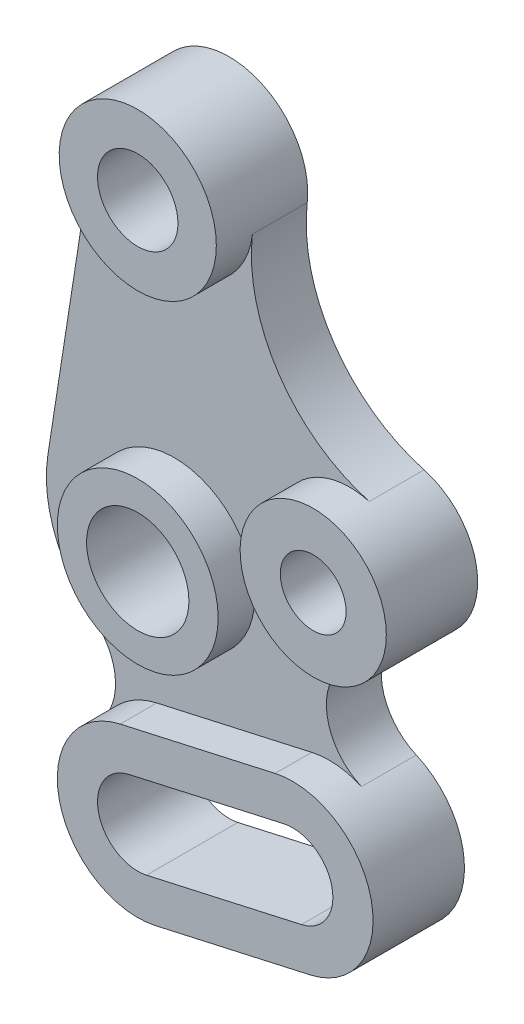
from build123d import *

# Parameters (mm, degrees)
SKETCH1_R           = 44
BOSS_EXTRUDE1_DEPTH = 30
SKETCH1_3_R         = 40
SKETCH1_3_R_2       = 18
SKETCH1_3_R_3       = 43
SKETCH1_3_R_4       = 22
SKETCH1_3_R_5       = 44
SKETCH1_3_R_6       = 28
BOSS_EXTRUDE2_DEPTH = 50


with BuildPart() as part:
    # Sketch1 → Boss-Extrude1 (new body)
    with BuildSketch(Plane.XY):
        with BuildLine():
            ThreePointArc((-37.152695317, -96.427192982), (-25.310496196, -84.008629057), (-9.618664602, -77.064218986))
            Line((-9.618664602, -77.064218986), (75.140384229, -58.076119936))
            ThreePointArc((75.140384229, -58.076119936), (88.978408325, -57.214674948), (102.397475744, -60.702027518))
            ThreePointArc((102.397475744, -60.702027518), (83.306238653, -29.112938991), (106.680790328, -0.547642184))
            ThreePointArc((106.680790328, -0.547642184), (56, 38), (106.680790328, 76.547642184))
            ThreePointArc((106.680790328, 76.547642184), (57.263244705, 112.084196354), (42.730356863, 171.192027211))
            ThreePointArc((42.730356863, 171.192027211), (-5.703537617, 133.379938308), (-42.49099891, 182.596590909))
            Line((-42.49099891, 182.596590909), (-69.171393575, 10.738636364))
            ThreePointArc((-69.171393575, 10.738636364), (-65.309307933, -25.193139885), (-44.040182506, -54.410130719))
            ThreePointArc((-44.040182506, -54.410130719), (-32.594285398, -74.106939259), (-37.152695317, -96.427192982))
        make_face()
        Circle(SKETCH1_R, mode=Mode.SUBTRACT)
    extrude(amount=BOSS_EXTRUDE1_DEPTH)

    # Sketch1<3> → Boss-Extrude2 (add)
    # profile 1 of 4: a face of its own
    with BuildSketch(Plane.XY):
        with BuildLine():
            Line((75.140384229, -58.076119936), (-9.618664602, -77.064218986))
            ThreePointArc((-9.618664602, -77.064218986), (-42.935781014, -129.618664602), (9.618664602, -162.935781014))
            Line((9.618664602, -162.935781014), (94.377713433, -143.947681963))
            ThreePointArc((94.377713433, -143.947681963), (127.694829845, -91.393236347), (75.140384229, -58.076119936))
        make_face()
        with BuildLine():
            ThreePointArc((4.809332301, -141.467890507), (-21.467890507, -124.809332301), (-4.809332301, -98.532109493))
            Line((-4.809332301, -98.532109493), (79.94971653, -79.544010443))
            ThreePointArc((79.94971653, -79.544010443), (106.226939338, -96.202568649), (89.568381132, -122.479791457))
            Line((89.568381132, -122.479791457), (4.809332301, -141.467890507))
        make_face(mode=Mode.SUBTRACT)
    # profile 2 of 4: a face of its own
    with BuildSketch(Plane.XY):
        with Locations((96, 38)):
            Circle(SKETCH1_3_R)
        with Locations((96, 38)):
            Circle(SKETCH1_3_R_2, mode=Mode.SUBTRACT)
    # profile 3 of 4: a face of its own
    with BuildSketch(Plane.XY):
        with Locations((0, 176)):
            Circle(SKETCH1_3_R_3)
        with Locations((0, 176)):
            Circle(SKETCH1_3_R_4, mode=Mode.SUBTRACT)
    # profile 4 of 4: a face of its own
    with BuildSketch(Plane.XY):
        Circle(SKETCH1_3_R_5)
        Circle(SKETCH1_3_R_6, mode=Mode.SUBTRACT)
    extrude(amount=BOSS_EXTRUDE2_DEPTH)


solid = part.part
